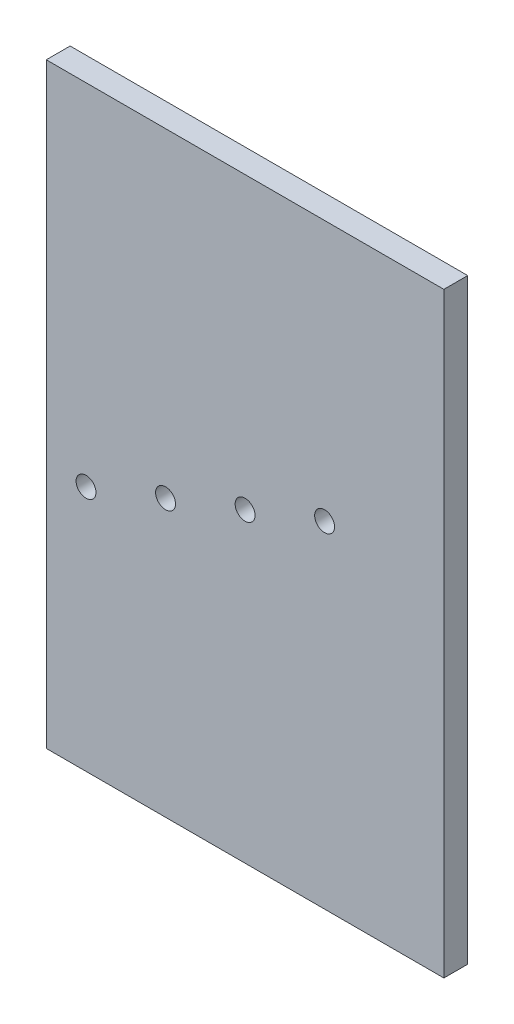
from build123d import *

# Parameters (mm, degrees)
ESQUISSE1_W             = 100
ESQUISSE1_H             = 150
BOSS_EXTRU_1_DEPTH      = 6
ESQUISSE2_R             = 2.5
ENL_V_MAT_EXTRU_1_DEPTH = 10


with BuildPart() as part:
    # Esquisse1 → Boss.-Extru.1 (new body)
    with BuildSketch(Plane.XY):
        with Locations((-50, 75)):
            Rectangle(ESQUISSE1_W, ESQUISSE1_H)
    extrude(amount=BOSS_EXTRU_1_DEPTH)

    # Esquisse2 → Enlèv. mat.-Extru.1 (cut)
    with BuildSketch(Plane.XY.offset(6)):
        with Locations((-90, 62)):
            Circle(ESQUISSE2_R)
        with Locations((-70, 69.5)):
            Circle(ESQUISSE2_R)
        with Locations((-30, 84.5)):
            Circle(ESQUISSE2_R)
        with Locations((-50, 77)):
            Circle(ESQUISSE2_R)
    extrude(amount=-ENL_V_MAT_EXTRU_1_DEPTH, mode=Mode.SUBTRACT)


solid = part.part
